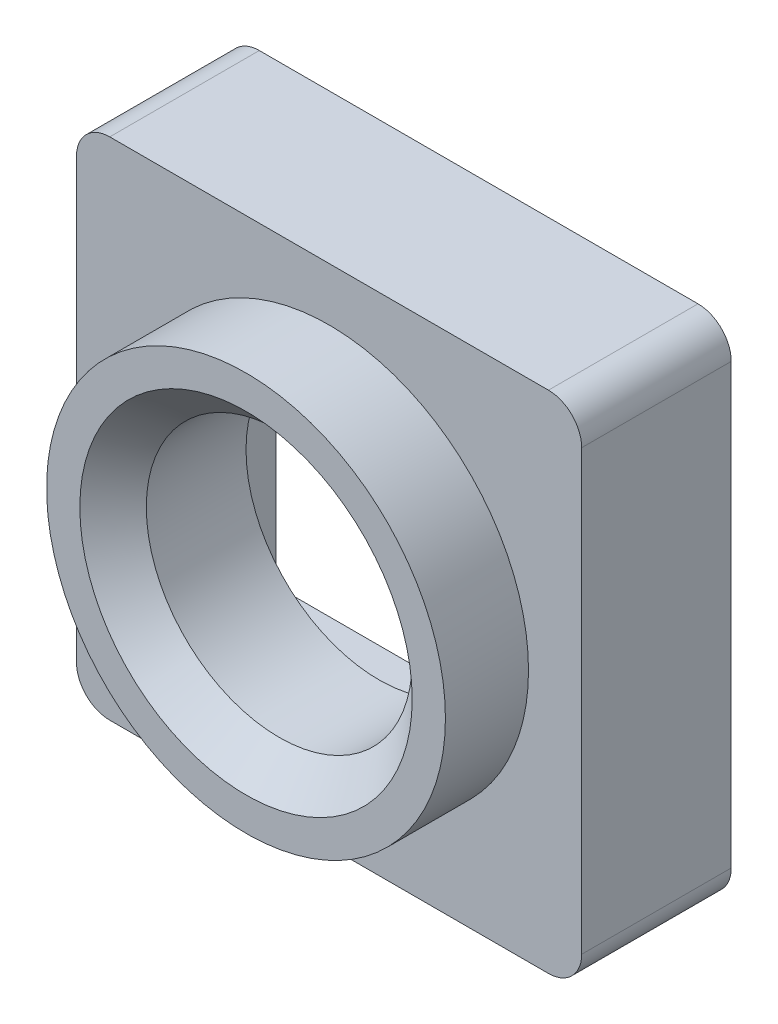
from build123d import *

# Parameters (mm, degrees)
SKETCH1_R      = 6
SKETCH1_R_2    = 4
EXTRUDE1_DEPTH = 2.5
CHAMFER1_SIZE  = 1
EXTRUDE3_START = 1.5
SKETCH2_W      = 15.2
SKETCH2_H      = 15.2
SKETCH2_R      = 4
EXTRUDE3_DEPTH = 1.5
SKETCH3_W      = 15.2
SKETCH3_H      = 15.2
SKETCH3_W_2    = 12.2
SKETCH3_H_2    = 12.2
EXTRUDE4_DEPTH = 3
FILLET1_R      = 1
FILLET2_R      = 0.5


with BuildPart() as part:
    # Sketch1 → Extrude1 (new body)
    with BuildSketch(Plane.XY):
        Circle(SKETCH1_R)
        Circle(SKETCH1_R_2, mode=Mode.SUBTRACT)
    extrude(amount=EXTRUDE1_DEPTH)

    # Chamfer1
    chamfer1_edges = [part.edges().sort_by_distance(p)[0] for p in [
        (-4, 0, 2.5),
    ]]
    chamfer(chamfer1_edges, length=CHAMFER1_SIZE)

    # Sketch2 → Extrude3 (add)
    with BuildSketch(Plane(origin=(0, 0, 0), x_dir=(-1, 0, 0), z_dir=(0, 0, -1)).offset(EXTRUDE3_START)):
        Rectangle(SKETCH2_W, SKETCH2_H)
        Circle(SKETCH2_R, mode=Mode.SUBTRACT)
    extrude(amount=-EXTRUDE3_DEPTH)

    # Sketch3 → Extrude4 (add)
    with BuildSketch(Plane(origin=(0, 0, -1.5), x_dir=(-1, 0, 0), z_dir=(0, 0, -1))):
        Rectangle(SKETCH3_W, SKETCH3_H)
        Rectangle(SKETCH3_W_2, SKETCH3_H_2, mode=Mode.SUBTRACT)
    extrude(amount=EXTRUDE4_DEPTH)

    # Fillet1
    fillet1_edges = [part.edges().sort_by_distance(p)[0] for p in [
        (-7.6, -7.6, -3),
        (-7.6, 7.6, -3),
        (7.6, 7.6, -3),
        (7.6, -7.6, -3),
    ]]
    fillet(fillet1_edges, radius=FILLET1_R)

    # Fillet2
    fillet2_edges = [part.edges().sort_by_distance(p)[0] for p in [
        (-6.1, 6.1, -3),
        (6.1, 6.1, -3),
        (6.1, -6.1, -3),
        (-6.1, -6.1, -3),
    ]]
    fillet(fillet2_edges, radius=FILLET2_R)


solid = part.part
